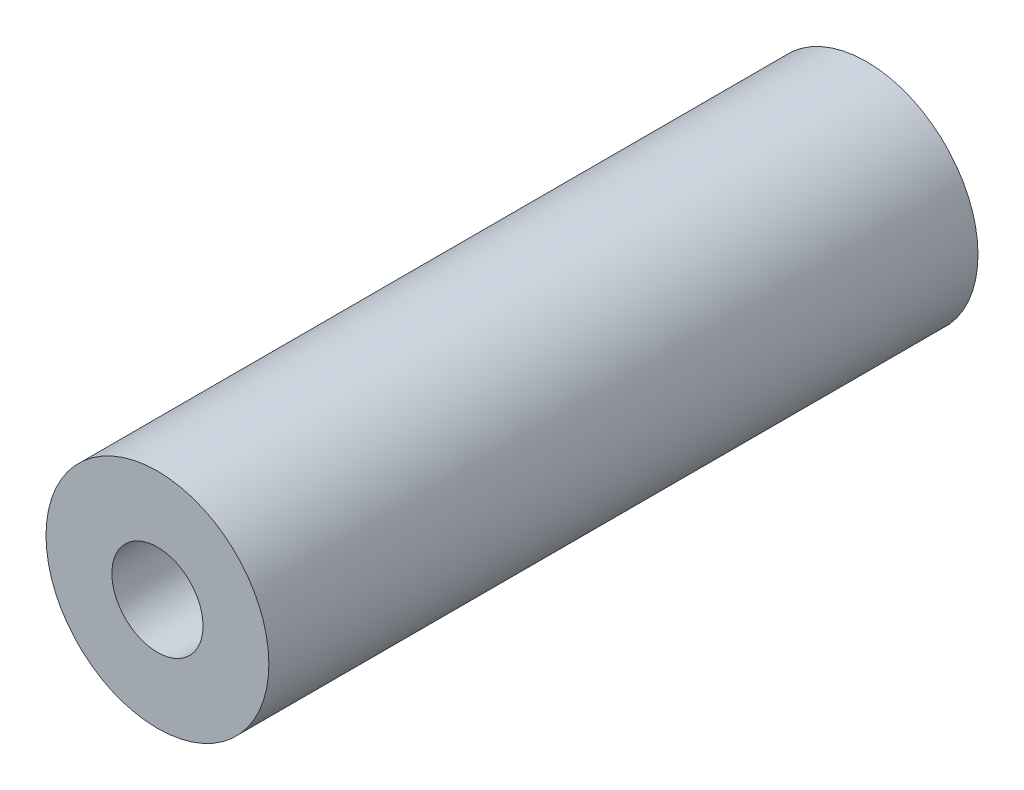
from build123d import *

# Parameters (mm, degrees)
SKETCH1_R           = 5.5
SKETCH1_R_2         = 2.25
BOSS_EXTRUDE1_DEPTH = 35


with BuildPart() as part:
    # Sketch1 → Boss-Extrude1 (new body)
    with BuildSketch(Plane.XY):
        Circle(SKETCH1_R)
        Circle(SKETCH1_R_2, mode=Mode.SUBTRACT)
    extrude(amount=BOSS_EXTRUDE1_DEPTH)


solid = part.part
